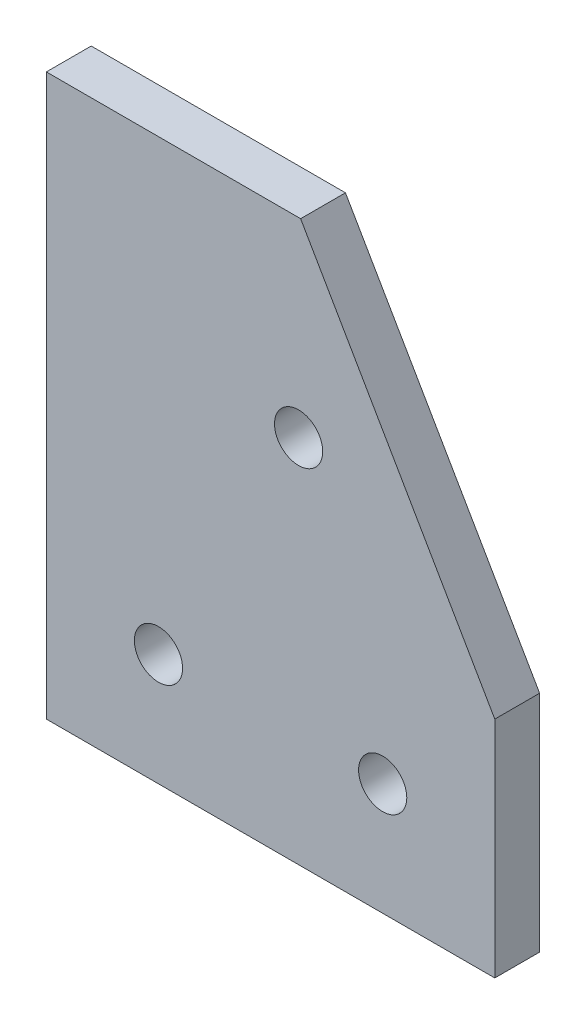
from build123d import *

# Parameters (mm, degrees)
SKETCH1_W           = 40
SKETCH1_H           = 50
BOSS_EXTRUDE1_DEPTH = 4
CUT_EXTRUDE2_DEPTH  = 33.26453161
SKETCH4_R           = 2.15
CUT_EXTRUDE3_DEPTH  = 33.26453161
SKETCH5_R           = 2.15
CUT_EXTRUDE4_DEPTH  = 33.26453161
SKETCH8_R           = 2.15
CUT_EXTRUDE5_DEPTH  = 33.26453161


with BuildPart() as part:
    # Sketch1 → Boss-Extrude1 (new body)
    with BuildSketch(Plane.XY):
        Rectangle(SKETCH1_W, SKETCH1_H)
    extrude(amount=BOSS_EXTRUDE1_DEPTH)

    # Sketch3 → Cut-Extrude2 (cut, through all)
    with BuildSketch(Plane.XY.offset(4)):
        Polygon((2.68, 25), (20, -5), (20, 25), align=None)
    extrude(amount=-CUT_EXTRUDE2_DEPTH, mode=Mode.SUBTRACT)

    # Sketch4 → Cut-Extrude3 (cut, through all)
    with BuildSketch(Plane.XY.offset(4)):
        with Locations((2.500165004, 7.990476321)):
            Circle(SKETCH4_R)
    extrude(amount=-CUT_EXTRUDE3_DEPTH, mode=Mode.SUBTRACT)

    # Sketch5 → Cut-Extrude4 (cut, through all)
    with BuildSketch(Plane.XY.offset(4)):
        with Locations((-10, -15)):
            Circle(SKETCH5_R)
    extrude(amount=-CUT_EXTRUDE4_DEPTH, mode=Mode.SUBTRACT)

    # Sketch8 → Cut-Extrude5 (cut, through all)
    with BuildSketch(Plane.XY.offset(4)):
        with Locations((10, -15)):
            Circle(SKETCH8_R)
    extrude(amount=-CUT_EXTRUDE5_DEPTH, mode=Mode.SUBTRACT)


solid = part.part
